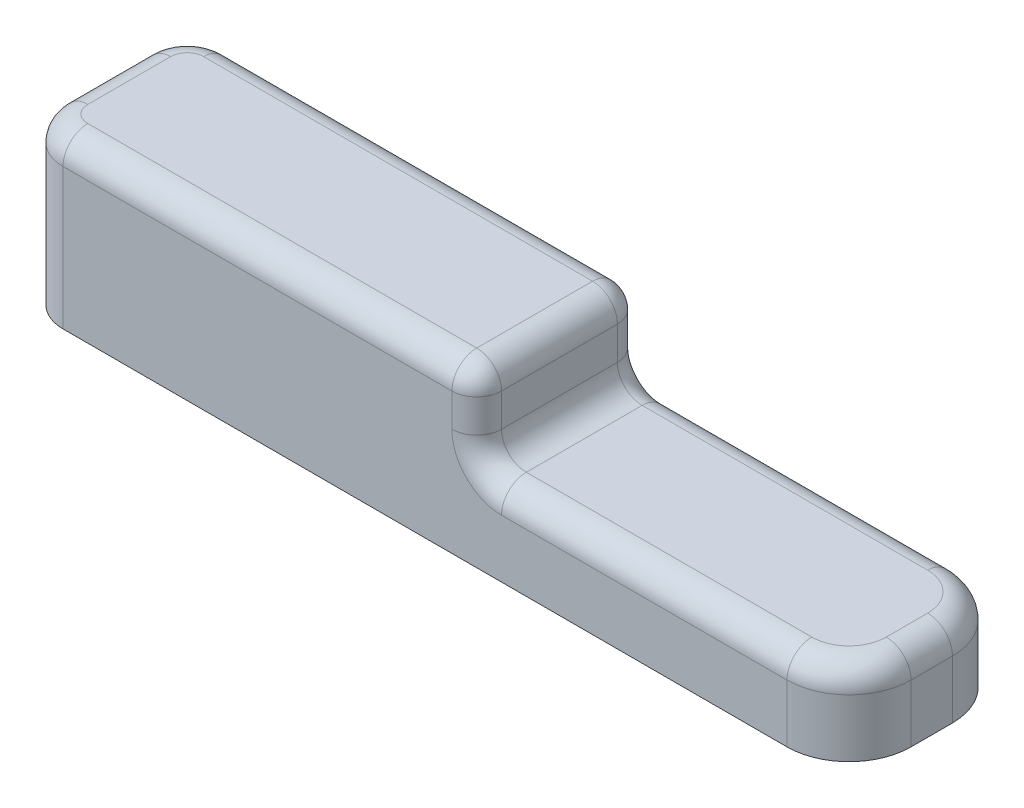
from build123d import *

# Parameters (mm, degrees)
SKETCH1_W                    = 100
SKETCH1_H                    = 20
BOSS_EXTRUDE1_DEPTH          = 20
FILLET1_R                    = 5
FILLET2_R                    = 7.5
CUT_EXTRUDE1_DEPTH           = 58.445626465
CUT_EXTRUDE1_DEPTH_BACK      = 58.445626465
SKETCH3_W                    = 45
SKETCH3_H                    = 10
FILLET3_R                    = 3
SHELL1_T                     = -1
BOSS_EXTRUDE3_REACH          = 56.772
M1_2X0_25_TAPPED_HOLE2_D     = 0.95
M1_2X0_25_TAPPED_HOLE2_DEPTH = 3.65
M1_2X0_25_TAPPED_HOLE2_TIP   = 0.285408794
M3_TAPPED_HOLE1_D            = 2.5
M3_TAPPED_HOLE1_DEPTH        = 8.5
M3_TAPPED_HOLE1_TIP          = 0.751075774


with BuildPart() as part:
    # Sketch1 → Boss-Extrude1 (new body)
    with BuildSketch(Plane(origin=(0, 0, 0), x_dir=(1, 0, 0), z_dir=(0, 1, 0))):
        Rectangle(SKETCH1_W, SKETCH1_H)
    extrude(amount=BOSS_EXTRUDE1_DEPTH)

    # Fillet1
    fillet1_edges = [part.edges().sort_by_distance(p)[0] for p in [
        (-50, 10, 10),
        (-50, 10, -10),
    ]]
    fillet(fillet1_edges, radius=FILLET1_R)

    # Fillet2
    fillet2_edges = [part.edges().sort_by_distance(p)[0] for p in [
        (50, 10, 10),
        (50, 10, -10),
    ]]
    fillet(fillet2_edges, radius=FILLET2_R)

    # Sketch3 → Cut-Extrude1 (cut, two sides: drawn at the far end of the back side and taken through both)
    with BuildSketch(Plane.XY.offset(10).offset(-CUT_EXTRUDE1_DEPTH_BACK)):
        with Locations((27.5, 15)):
            Rectangle(SKETCH3_W, SKETCH3_H)
    extrude(amount=CUT_EXTRUDE1_DEPTH + CUT_EXTRUDE1_DEPTH_BACK, mode=Mode.SUBTRACT)

    # Fillet3
    fillet3_edges = [part.edges().sort_by_distance(p)[0] for p in [
        (-50, 20, 0),
        (-20, 20, 10),
        (-48.535533906, 20, 8.535533906),
        (-48.535533906, 20, -8.535533906),
        (47.803300859, 10, 7.803300859),
        (-20, 20, -10),
        (5, 10, 0),
        (5, 15, 10),
        (5, 15, -10),
        (5, 20, 0),
        (47.803300859, 10, -7.803300859),
        (50, 10, 0),
        (23.75, 10, 10),
        (23.75, 10, -10),
    ]]
    fillet(fillet3_edges, radius=FILLET3_R)

    # Shell1
    shell1_openings = [part.faces().sort_by_distance(p)[0] for p in [
        (-0.326782527, 0, 0),
    ]]
    offset(amount=SHELL1_T, openings=shell1_openings, kind=Kind.INTERSECTION)

    # Sketch4 → Boss-Extrude3 (add, up to next)
    with BuildSketch(Plane.XZ, mode=Mode.PRIVATE) as boss_extrude3_sk1:
        with BuildLine():
            Line((1.5, -7.5), (1.5, -9))
            Line((1.5, -9), (3.5, -9))
            Line((3.5, -9), (3.5, -7.5))
            ThreePointArc((3.5, -7.5), (2.5, -6.5), (1.5, -7.5))
        make_face()
    boss_extrude3_tool1 = extrude(boss_extrude3_sk1.sketch, amount=-BOSS_EXTRUDE3_REACH, mode=Mode.PRIVATE) - part.part
    # Sketch4 → Boss-Extrude3 (add, up to next)
    with BuildSketch(Plane.XZ, mode=Mode.PRIVATE) as boss_extrude3_sk2:
        with BuildLine():
            Line((1.5, 7.5), (1.5, 9))
            Line((1.5, 9), (3.5, 9))
            Line((3.5, 9), (3.5, 7.5))
            ThreePointArc((3.5, 7.5), (2.5, 6.5), (1.5, 7.5))
        make_face()
    boss_extrude3_tool2 = extrude(boss_extrude3_sk2.sketch, amount=-BOSS_EXTRUDE3_REACH, mode=Mode.PRIVATE) - part.part
    # Sketch4 → Boss-Extrude3 (add, up to next)
    with BuildSketch(Plane.XZ, mode=Mode.PRIVATE) as boss_extrude3_sk3:
        with BuildLine():
            Line((41.5, -7.5), (41.5, -9))
            Line((41.5, -9), (43.5, -9))
            Line((43.5, -9), (43.5, -7.5))
            ThreePointArc((43.5, -7.5), (42.5, -6.5), (41.5, -7.5))
        make_face()
    boss_extrude3_tool3 = extrude(boss_extrude3_sk3.sketch, amount=-BOSS_EXTRUDE3_REACH, mode=Mode.PRIVATE) - part.part
    # Sketch4 → Boss-Extrude3 (add, up to next)
    with BuildSketch(Plane.XZ, mode=Mode.PRIVATE) as boss_extrude3_sk4:
        with BuildLine():
            Line((41.5, 7.5), (41.5, 9))
            Line((41.5, 9), (43.5, 9))
            Line((43.5, 9), (43.5, 7.5))
            ThreePointArc((43.5, 7.5), (42.5, 6.5), (41.5, 7.5))
        make_face()
    boss_extrude3_tool4 = extrude(boss_extrude3_sk4.sketch, amount=-BOSS_EXTRUDE3_REACH, mode=Mode.PRIVATE) - part.part
    # Sketch4 → Boss-Extrude3 (add, up to next)
    with BuildSketch(Plane.XZ, mode=Mode.PRIVATE) as boss_extrude3_sk5:
        with BuildLine():
            Line((47, 2.431166482), (49, 2.431166482))
            Line((49, 2.431166482), (49, -1.568833518))
            Line((49, -1.568833518), (47, -1.568833518))
            ThreePointArc((47, -1.568833518), (45, 0.431166482), (47, 2.431166482))
        make_face()
    boss_extrude3_tool5 = extrude(boss_extrude3_sk5.sketch, amount=-BOSS_EXTRUDE3_REACH, mode=Mode.PRIVATE) - part.part
    # Sketch4 → Boss-Extrude3 (add, up to next)
    with BuildSketch(Plane.XZ, mode=Mode.PRIVATE) as boss_extrude3_sk6:
        with BuildLine():
            Line((-47, 2), (-49, 2))
            Line((-49, 2), (-49, -2))
            Line((-49, -2), (-47, -2))
            ThreePointArc((-47, -2), (-45, 0), (-47, 2))
        make_face()
    boss_extrude3_tool6 = extrude(boss_extrude3_sk6.sketch, amount=-BOSS_EXTRUDE3_REACH, mode=Mode.PRIVATE) - part.part
    add(boss_extrude3_tool1.solids().sort_by_distance((2.5, 0, -7.846402))[0])
    add(boss_extrude3_tool2.solids().sort_by_distance((2.5, 0, 7.846402))[0])
    add(boss_extrude3_tool3.solids().sort_by_distance((42.5, 0, -7.846402))[0])
    add(boss_extrude3_tool4.solids().sort_by_distance((42.5, 0, 7.846402))[0])
    add(boss_extrude3_tool5.solids().sort_by_distance((47.1867, 0, 0.431166))[0])
    add(boss_extrude3_tool6.solids().sort_by_distance((-47.1867, 0, 0))[0])

    # M1.2x0.25 Tapped Hole2
    with Locations(Plane(origin=(0, 0, 0), x_dir=(-1, 0, 0), z_dir=(0, -1, 0))):
        with Locations((-2.5, -7.5), (-2.5, 7.5), (-42.5, 7.5), (-42.5, -7.5)):
            Hole(M1_2X0_25_TAPPED_HOLE2_D / 2, depth=M1_2X0_25_TAPPED_HOLE2_DEPTH)
            with Locations((0, 0, -(M1_2X0_25_TAPPED_HOLE2_DEPTH + M1_2X0_25_TAPPED_HOLE2_TIP / 2))):  # 118° drill point
                Cone(0, M1_2X0_25_TAPPED_HOLE2_D / 2, M1_2X0_25_TAPPED_HOLE2_TIP, mode=Mode.SUBTRACT)

    # M3 Tapped Hole1
    with Locations(Plane(origin=(0, 0, 0), x_dir=(-1, 0, 0), z_dir=(0, -1, 0))):
        with Locations((-47, -0.431166482), (47, 0)):
            Hole(M3_TAPPED_HOLE1_D / 2, depth=M3_TAPPED_HOLE1_DEPTH)
            with Locations((0, 0, -(M3_TAPPED_HOLE1_DEPTH + M3_TAPPED_HOLE1_TIP / 2))):  # 118° drill point
                Cone(0, M3_TAPPED_HOLE1_D / 2, M3_TAPPED_HOLE1_TIP, mode=Mode.SUBTRACT)


solid = part.part
